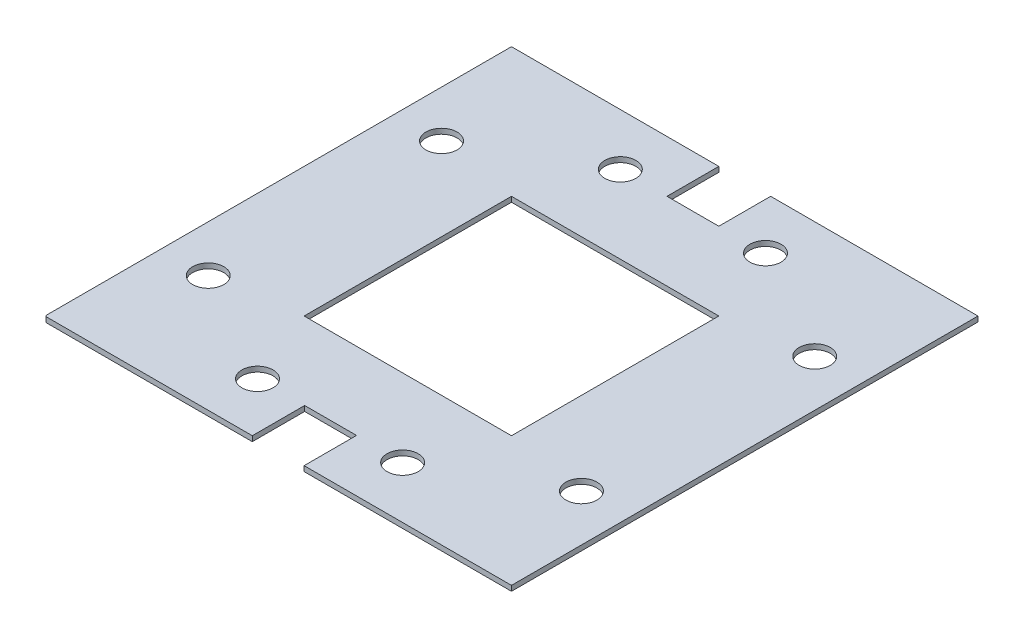
from build123d import *

# Parameters (mm, degrees)
CROQUIS1_R              = 1.5
CROQUIS1_W              = 20
CROQUIS1_H              = 20
SALIENTE_EXTRUIR1_DEPTH = 0.5
CROQUIS3_W              = 5
CROQUIS3_H              = 5
CROQUIS3_H_2            = 5.050773409
CORTAR_EXTRUIR2_DEPTH   = 10


with BuildPart() as part:
    # Croquis1 → Saliente-Extruir1 (new body)
    with BuildSketch(Plane(origin=(0, 0, 0), x_dir=(1, 0, 0), z_dir=(0, 1, 0))):
        with BuildLine():
            ThreePointArc((-12.5, -12.398453182), (-12.449747468, -12.449747468), (-12.398453182, -12.5))
            Line((-12.398453182, -12.5), (32.5, -12.5))
            Line((32.5, -12.5), (32.5, 32.5))
            Line((32.5, 32.5), (-12.5, 32.5))
            Line((-12.5, 32.5), (-12.5, -12.398453182))
        make_face()
        with Locations(Location((3, -7.5, 0), (0, 0, 270))):
            Circle(CROQUIS1_R, mode=Mode.SUBTRACT)
        with Locations(Location((-8, -1.25, 0), (0, 0, 270))):
            Circle(CROQUIS1_R, mode=Mode.SUBTRACT)
        with Locations(Location((17, -7.5, 0), (0, 0, 270))):
            Circle(CROQUIS1_R, mode=Mode.SUBTRACT)
        with Locations(Location((28, -1.25, 0), (0, 0, 270))):
            Circle(CROQUIS1_R, mode=Mode.SUBTRACT)
        with Locations(Location((-8, 21.25, 0), (0, 0, 270))):
            Circle(CROQUIS1_R, mode=Mode.SUBTRACT)
        with Locations(Location((3, 27.5, 0), (0, 0, 270))):
            Circle(CROQUIS1_R, mode=Mode.SUBTRACT)
        with Locations((10, 10)):
            Rectangle(CROQUIS1_W, CROQUIS1_H, mode=Mode.SUBTRACT)
        with Locations(Location((17, 27.5, 0), (0, 0, 270))):
            Circle(CROQUIS1_R, mode=Mode.SUBTRACT)
        with Locations(Location((28, 21.25, 0), (0, 0, 270))):
            Circle(CROQUIS1_R, mode=Mode.SUBTRACT)
    extrude(amount=SALIENTE_EXTRUIR1_DEPTH)

    # Croquis3 → Cortar-Extruir2 (cut)
    with BuildSketch(Plane(origin=(0, 0.5, 0), x_dir=(1, 0, 0), z_dir=(0, 1, 0))):
        with Locations((10, 30)):
            Rectangle(CROQUIS3_W, CROQUIS3_H)
        with Locations((10, -9.974613295)):
            Rectangle(CROQUIS3_W, CROQUIS3_H_2)
    extrude(amount=-CORTAR_EXTRUIR2_DEPTH, mode=Mode.SUBTRACT)


solid = part.part
